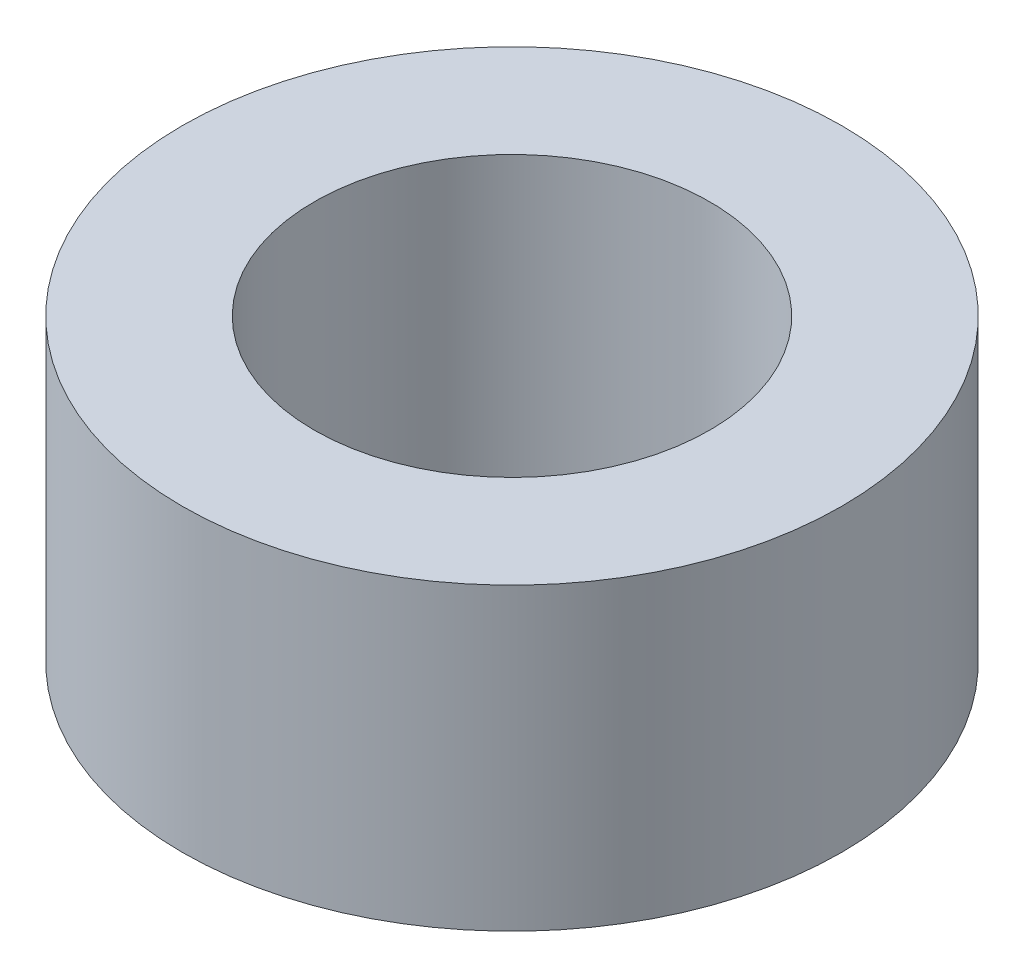
from build123d import *

# Parameters (mm, degrees)
SKETCH1_W            = 11
SKETCH1_H            = 11
BOSS_EXTRUDE1_DEPTH  = 5
M6_CLEARANCE_HOLE1_D = 6.6
SKETCH4_OUTSIDE_W    = 16.268
SKETCH4_OUTSIDE_H    = 16.268
SKETCH4_OUTSIDE_R    = 5.5
CUT_EXTRUDE1_DEPTH   = 10.246621004


with BuildPart() as part:
    # Sketch1 → Boss-Extrude1 (new body)
    with BuildSketch(Plane(origin=(0, 0, 0), x_dir=(1, 0, 0), z_dir=(0, 1, 0))):
        Rectangle(SKETCH1_W, SKETCH1_H)
    extrude(amount=BOSS_EXTRUDE1_DEPTH)

    # M6 Clearance Hole1 (through all)
    with Locations(Plane(origin=(0, 5, 0), x_dir=(1, 0, 0), z_dir=(0, 1, 0))):
        with Locations((0, 0)):
            Hole(M6_CLEARANCE_HOLE1_D / 2)

    # Sketch4 outside → Cut-Extrude1 (cut, through all)
    with BuildSketch(Plane(origin=(0, 5, 0), x_dir=(1, 0, 0), z_dir=(0, 1, 0))):
        Rectangle(SKETCH4_OUTSIDE_W, SKETCH4_OUTSIDE_H)
        with Locations(Location((0, 0, 0), (0, 0, 270))):
            Circle(SKETCH4_OUTSIDE_R, mode=Mode.SUBTRACT)
    extrude(amount=-CUT_EXTRUDE1_DEPTH, mode=Mode.SUBTRACT)


solid = part.part
